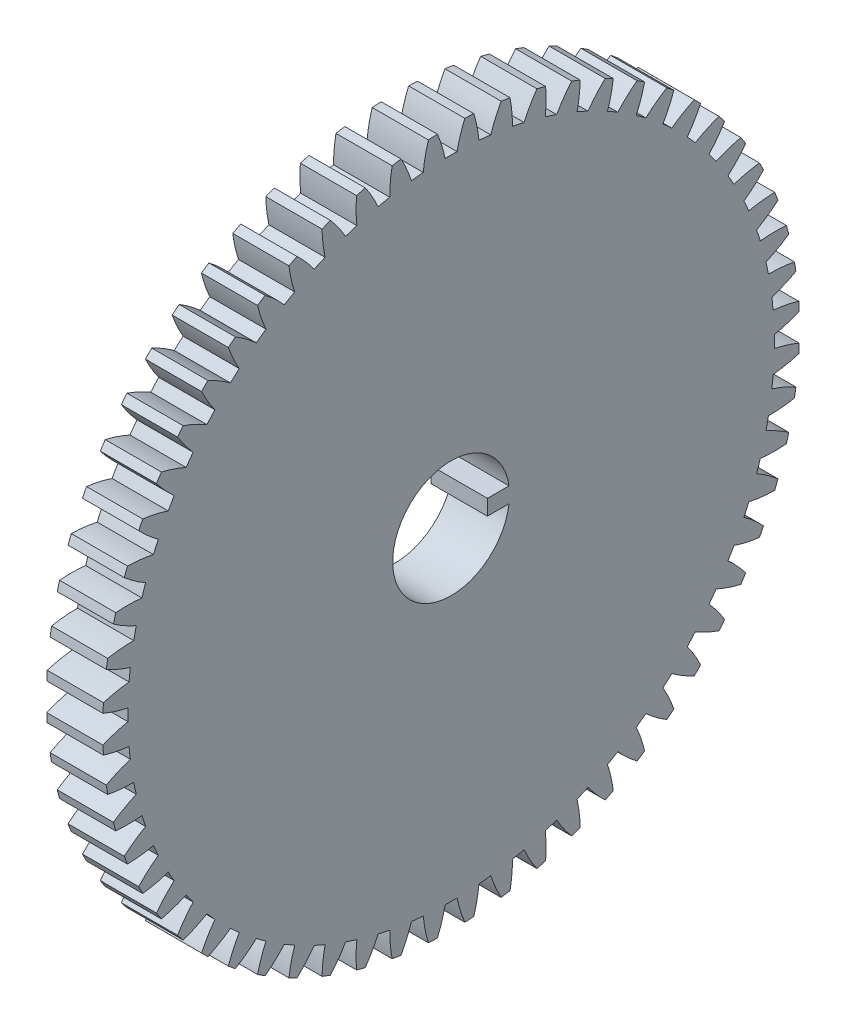
from build123d import *

# Parameters (mm, degrees)
BASPROSKE_W         = 6.35
BASPROSKE_H         = 39.37
TOOTHCUT_DEPTH      = 57.038525141
TEETHCUTS_COUNT     = 60
TEETHCUTS_ANGLE     = 354
BORSKE_R            = 6.604
BORE_DEPTH          = 50.8000508
BOSS_EXTRUDE1_DEPTH = 6.35


with BuildPart() as part:
    # BasProSke → Base-Revolve (revolve)
    with BuildSketch(Plane(origin=(0, 0, 0), x_dir=(1, 0, 0), z_dir=(0, 1, 0)), mode=Mode.PRIVATE) as base_revolve_sk:
        with Locations((3.175, 19.685)):
            Rectangle(BASPROSKE_W, BASPROSKE_H)
    revolve(base_revolve_sk.sketch.rotate(Axis((-10, 0, 0), (1, 0, 0)), 180), axis=Axis((-10, 0, 0), (1, 0, 0)))

    # TooCutSke → ToothCut (cut, through all)
    with BuildSketch(Plane(origin=(0, 0, 0), x_dir=(0, 0, -1), z_dir=(1, 0, 0))):
        with BuildLine():
            ThreePointArc((0.674018167, 36.51898047), (0, 36.5252), (-0.674018167, 36.51898047))
            ThreePointArc((-0.674018167, 36.51898047), (-1.047934425, 37.963458687), (-1.561312288, 39.364449))
            ThreePointArc((-1.561312288, 39.364449), (0, 39.3954), (1.561312288, 39.364449))
            ThreePointArc((1.561312288, 39.364449), (1.047934425, 37.963458687), (0.674018167, 36.51898047))
        make_face()
    toothcut = extrude(amount=TOOTHCUT_DEPTH, mode=Mode.SUBTRACT)

    # TeethCuts: ToothCut ×60 about axis
    teethcuts_axis = Axis((-10, 0, 0), (1, 0, 0))
    for i in range(1, TEETHCUTS_COUNT):
        add(toothcut.rotate(teethcuts_axis, i * TEETHCUTS_ANGLE / (TEETHCUTS_COUNT - 1)), mode=Mode.SUBTRACT)

    # BorSke → Bore (cut, symmetric)
    with BuildSketch(Plane(origin=(0, 0, 0), x_dir=(0, 0, -1), z_dir=(1, 0, 0))):
        with Locations(Location((0, 0, 0), (0, 0, 180))):
            Circle(BORSKE_R)
    extrude(amount=BORE_DEPTH, both=True, mode=Mode.SUBTRACT)

    # Sketch1 → Boss-Extrude1 (add)
    with BuildSketch(Plane(origin=(6.35, 0, 0), x_dir=(0, 0, -1), z_dir=(1, 0, 0))):
        with BuildLine():
            Line((4.104, 0), (6.604, 0))
            ThreePointArc((6.604, 0), (6.589428068, 0.438467492), (6.545776577, 0.875))
            Line((6.545776577, 0.875), (4.104, 0.875))
            Line((4.104, 0.875), (4.104, 0))
        make_face()
        with BuildLine():
            ThreePointArc((6.545776577, -0.875), (6.589428068, -0.438467492), (6.604, 0))
            Line((6.604, 0), (4.104, 0))
            Line((4.104, 0), (4.104, -0.875))
            Line((4.104, -0.875), (6.545776577, -0.875))
        make_face()
    extrude(amount=-BOSS_EXTRUDE1_DEPTH)


solid = part.part
